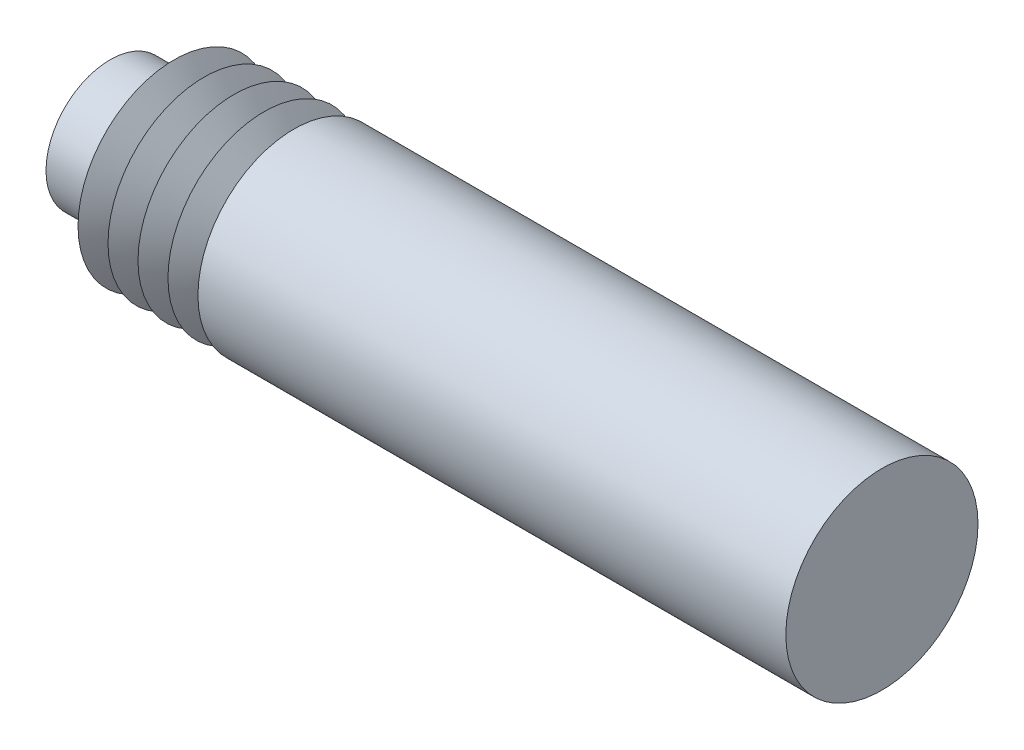
from build123d import *


with BuildPart() as part:
    # Esboço1 → Revolução1 (revolve)
    with BuildSketch(Plane.XY, mode=Mode.PRIVATE) as revolu_o1_sk:
        Polygon((-15.245, 0), (-15.245, 2.5), (-30.125, 2.5), (-30.125, 5), (-25.125, 5), (-25.125, 7.5), (-23.955, 5.7), (-22.785, 7.5), (-21.615, 5.7), (-20.445, 7.5), (-19.275, 5.7), (-18.105, 7.5), (-16.935, 5.7), (-15.765, 7.5), (30.125, 7.5), (30.125, 0), align=None)
    revolve(revolu_o1_sk.sketch.rotate(Axis((0, 0, 0), (1, 0, 0)), 90), axis=Axis((0, 0, 0), (1, 0, 0)))


solid = part.part
